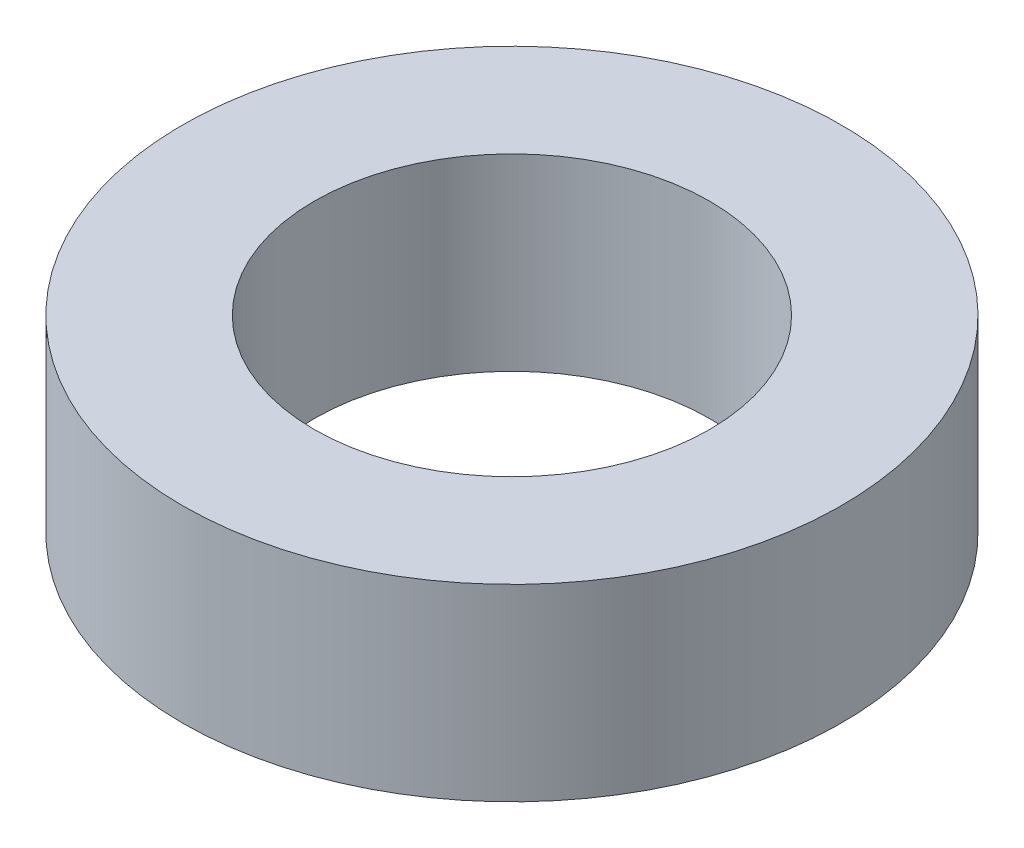
from build123d import *

# Parameters (mm, degrees)
SKETCH_1_R      = 3.5
SKETCH_1_R_2    = 2.1
EXTRUDE_1_DEPTH = 2


with BuildPart() as part:
    # 草图1 → 凸台-拉伸1 (new body)
    with BuildSketch(Plane(origin=(0, 0, 0), x_dir=(1, 0, 0), z_dir=(0, 1, 0))):
        with Locations(Location((0, 0, 0), (0, 0, 270))):
            Circle(SKETCH_1_R)
        with Locations(Location((0, 0, 0), (0, 0, 270))):
            Circle(SKETCH_1_R_2, mode=Mode.SUBTRACT)
    extrude(amount=EXTRUDE_1_DEPTH)


solid = part.part
